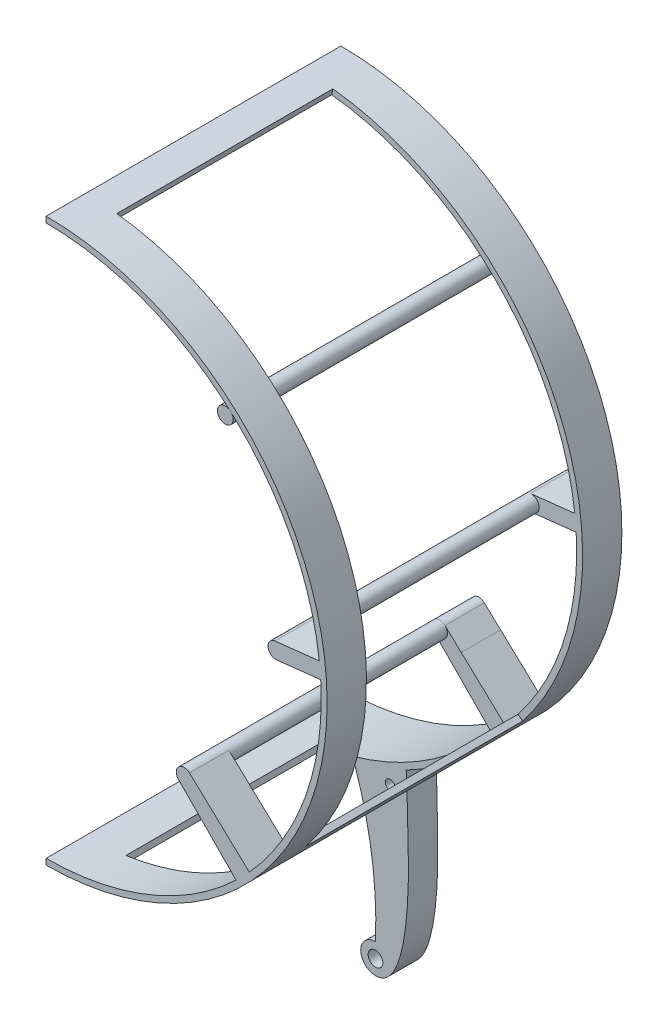
from build123d import *

# Parameters (mm, degrees)
BOSS_EXTRUDE1_DEPTH            = 75
SKETCH2_R                      = 3.75
SKETCH2_R_2                    = 2.5
BOSS_EXTRUDE2_DEPTH            = 7.5
SKETCH4_R                      = 4
BOSS_EXTRUDE3_DEPTH            = 75
BOSS_EXTRUDE3_2_DEPTH          = 75
BOSS_EXTRUDE3_3_DEPTH          = 75
BOSS_EXTRUDE4_DEPTH            = 20
BOSS_EXTRUDE5_START            = -20
BOSS_EXTRUDE5_DEPTH            = 20
CUT_EXTRUDE1_REACH             = 279.369
CUT_EXTRUDE1_DIRECTION_2_REACH = 279.369
CUT_EXTRUDE2_START             = 55
CUT_EXTRUDE2_DEPTH             = 97.6


with BuildPart() as part:
    # Sketch1 → Boss-Extrude1 (new, symmetric)
    with BuildSketch(Plane.XY):
        with BuildLine():
            Line((0, -143), (0, -140))
            ThreePointArc((0, -140), (140, 0), (0, 140))
            Line((0, 140), (0, 143))
            ThreePointArc((0, 143), (143, 0), (0, -143))
        make_face()
    extrude(amount=BOSS_EXTRUDE1_DEPTH, both=True)

    # Sketch2 → Boss-Extrude2 (add, symmetric)
    with BuildSketch(Plane.XY.offset(-50.1)):
        with BuildLine():
            Line((39.363217393, -137.475587347), (65.554031459, -126.341679479))
            add(Edge.make_bspline(
                [(50, -225.520515721), (63.887998116, -225.556737142), (66.67238478, -185.518594671), (66.828546925, -159.226599882), (65.837335245, -126.434753235), (65.554031459, -126.341679479)],
                knots=[0, 0, 0, 0, 0.384311141, 0.484311141, 1, 1, 1, 1], degree=3))
            ThreePointArc((50, -225.520515721), (42.498579173, -218.019094893), (50, -210.517674065))
            add(Edge.make_bspline(
                [(50, -210.517674065), (51.57981302, -173.041328894), (39.363217393, -137.475587347)],
                knots=[0, 0, 0, 1, 1, 1], degree=2))
        make_face()
        with Locations((50, -218.019094893)):
            Circle(SKETCH2_R, mode=Mode.SUBTRACT)
        with Locations((57.491500901, -137.736557679)):
            Circle(SKETCH2_R_2, mode=Mode.SUBTRACT)
    extrude(amount=BOSS_EXTRUDE2_DEPTH, both=True)



with BuildPart() as body_2:
    # Sketch4 → Boss-Extrude3 (new, symmetric)
    with BuildSketch(Plane.XY):
        with Locations((91.162122312, 100.923076923)):
            Circle(SKETCH4_R)
    extrude(amount=BOSS_EXTRUDE3_DEPTH, both=True)


with BuildPart() as body_3:
    # Sketch4 → Boss-Extrude3 2 (new, symmetric)
    with BuildSketch(Plane.XY):
        with Locations((116.917789305, 10.055391378)):
            Circle(SKETCH4_R)
    extrude(amount=BOSS_EXTRUDE3_2_DEPTH, both=True)


with BuildPart() as body_4:
    # Sketch4 → Boss-Extrude3 3 (new, symmetric)
    with BuildSketch(Plane.XY):
        with Locations((70.2496561, -68.810262197)):
            Circle(SKETCH4_R)
    extrude(amount=BOSS_EXTRUDE3_3_DEPTH, both=True)


with BuildPart() as part_1:
    add(part.part)

    add(body_3.part)  # Boss-Extrude4 merges body 3

    add(body_4.part)  # Boss-Extrude4 merges body 4
    # Sketch5 → Boss-Extrude4 (add)
    with BuildSketch(Plane.XY.offset(75)):
        with BuildLine():
            Line((67.401768733, -71.619094256), (98.381901585, -103.029989292))
            Line((98.381901585, -103.029989292), (105.049019097, -95.905716398))
            Line((105.049019097, -95.905716398), (72.983189134, -65.890022967))
            ThreePointArc((72.983189134, -65.890022967), (67.384549874, -66.018996119), (67.401768733, -71.619094256))
        make_face()
        with BuildLine():
            Line((116.478891692, 14.031239575), (141.138532223, 16.753440429))
            Line((141.138532223, 16.753440429), (142.249629521, 8.874750499))
            Line((142.249629521, 8.874750499), (117.364141838, 6.080373213))
            ThreePointArc((117.364141838, 6.080373213), (112.942354376, 9.612766111), (116.478891692, 14.031239575))
        make_face()
    extrude(amount=-BOSS_EXTRUDE4_DEPTH)

    # Sketch10 → Boss-Extrude5 (add)
    with BuildSketch(Plane(origin=(0, 0, -75), x_dir=(-1, 0, 0), z_dir=(0, 0, -1)).offset(BOSS_EXTRUDE5_START)):
        with BuildLine():
            Line((-81.264011417, -73.641408891), (-72.983462218, -65.889881022))
            ThreePointArc((-72.983462218, -65.889881022), (-67.384311741, -66.01882461), (-67.401694813, -71.619432644))
            Line((-67.401694813, -71.619432644), (-71.715374438, -75.992678343))
            Line((-71.715374438, -75.992678343), (-97.325013163, -101.9559515))
            Line((-97.325013163, -101.9559515), (-103.909527759, -94.839078712))
            Line((-103.909527759, -94.839078712), (-81.264011417, -73.641408891))
        make_face()
        with BuildLine():
            Line((-129.782763697, 15.499866488), (-116.478891692, 14.031239575))
            ThreePointArc((-116.478891692, 14.031239575), (-112.942354376, 9.612766111), (-117.364141838, 6.080373213))
            Line((-117.364141838, 6.080373213), (-131.965987804, 7.720006208))
            Line((-131.965987804, 7.720006208), (-140.617435242, 8.675047607))
            Line((-140.617435242, 8.675047607), (-139.74266415, 16.599349243))
            Line((-139.74266415, 16.599349243), (-129.782763697, 15.499866488))
        make_face()
    extrude(amount=BOSS_EXTRUDE5_DEPTH)

    # Cut-Extrude1: up to this face of the body (flat: up to its plane)
    cut_extrude1_end = Plane(part_1.part.faces().sort_by_distance((86.667869267, -84.804189346, -55))[0])
    # Sketch14 → Cut-Extrude1 (cut, up to the picked face)
    with BuildSketch(Plane.XY, mode=Mode.PRIVATE) as cut_extrude1_sk1:
        with BuildLine():
            Line((110.051344731, -86.371192556), (112.492031713, -88.286707953))
            ThreePointArc((112.492031713, -88.286707953), (135.422167186, -45.932958044), (142.990696216, 1.631194555))
            ThreePointArc((142.990696216, 1.631194555), (132.444265959, 53.921391068), (103.468128704, 98.708390436))
            ThreePointArc((103.468128704, 98.708390436), (63.526472944, 128.114742459), (15.942412546, 142.108548238))
            Line((15.942412546, 142.108548238), (15.307393475, 139.057416507))
            ThreePointArc((15.307393475, 139.057416507), (62.224281222, 125.297327214), (101.540783348, 96.232794295))
            ThreePointArc((101.540783348, 96.232794295), (129.704714642, 52.421068096), (139.890944357, 1.343527996))
            ThreePointArc((139.890944357, 1.343527996), (132.443403079, -45.055813849), (110.051344731, -86.371192556))
        make_face()
    cut_extrude1_tool1 = split(extrude(cut_extrude1_sk1.sketch, amount=-CUT_EXTRUDE1_REACH, mode=Mode.PRIVATE), bisect_by=cut_extrude1_end, keep=Keep.BOTH, mode=Mode.PRIVATE)
    add(cut_extrude1_tool1.solids().sort_by(Axis((132.146944, 53.408112, 0), (0, 0, -1)))[0], mode=Mode.SUBTRACT)

    # Cut-Extrude1 direction 2: up to this face of the body (flat: up to its plane)
    cut_extrude1_direction_2_end = Plane(part_1.part.faces().sort_by_distance((86.668305804, -84.805185214, 55))[0])
    # Sketch14 → Cut-Extrude1 direction 2 (cut, up to the picked face)
    with BuildSketch(Plane.XY, mode=Mode.PRIVATE) as cut_extrude1_direction_2_sk1:
        with BuildLine():
            Line((110.051344731, -86.371192556), (112.492031713, -88.286707953))
            ThreePointArc((112.492031713, -88.286707953), (135.422167186, -45.932958044), (142.990696216, 1.631194555))
            ThreePointArc((142.990696216, 1.631194555), (132.444265959, 53.921391068), (103.468128704, 98.708390436))
            ThreePointArc((103.468128704, 98.708390436), (63.526472944, 128.114742459), (15.942412546, 142.108548238))
            Line((15.942412546, 142.108548238), (15.307393475, 139.057416507))
            ThreePointArc((15.307393475, 139.057416507), (62.224281222, 125.297327214), (101.540783348, 96.232794295))
            ThreePointArc((101.540783348, 96.232794295), (129.704714642, 52.421068096), (139.890944357, 1.343527996))
            ThreePointArc((139.890944357, 1.343527996), (132.443403079, -45.055813849), (110.051344731, -86.371192556))
        make_face()
    cut_extrude1_direction_2_tool1 = split(extrude(cut_extrude1_direction_2_sk1.sketch, amount=CUT_EXTRUDE1_DIRECTION_2_REACH, mode=Mode.PRIVATE), bisect_by=cut_extrude1_direction_2_end, keep=Keep.BOTH, mode=Mode.PRIVATE)
    add(cut_extrude1_direction_2_tool1.solids().sort_by(Axis((132.146944, 53.408112, 0), (0, 0, 1)))[0], mode=Mode.SUBTRACT)

    # Sketch15 → Cut-Extrude2 (cut)
    with BuildSketch(Plane.XY.offset(CUT_EXTRUDE2_START)):
        with BuildLine():
            Line((86.535288516, -110.052913826), (88.389616127, -112.41119055))
            ThreePointArc((88.389616127, -112.41119055), (56.588634549, -131.326792544), (20.998927999, -141.449796829))
            Line((20.998927999, -141.449796829), (20.558391048, -138.482318574))
            ThreePointArc((20.558391048, -138.482318574), (55.401460398, -128.571685008), (86.535288516, -110.052913826))
        make_face()
    extrude(amount=-CUT_EXTRUDE2_DEPTH, mode=Mode.SUBTRACT)


solid = Compound([body_2.part, part_1.part])
